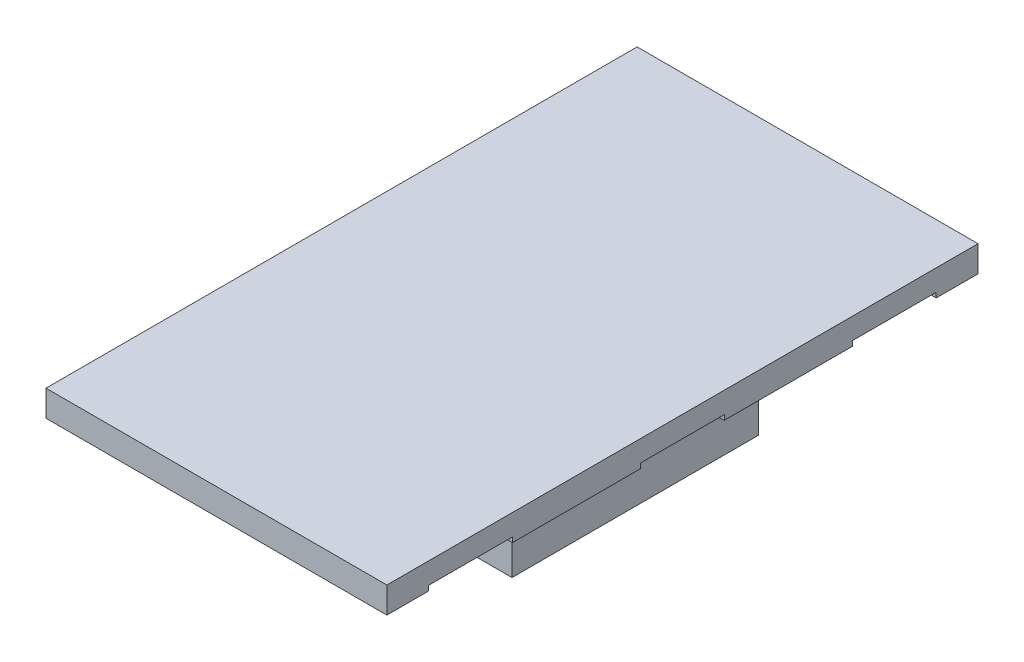
from build123d import *

# Parameters (mm, degrees)
SKETCH1_W           = 6.92
SKETCH1_H           = 12
BOSS_EXTRUDE1_DEPTH = 0.53
SKETCH2_W           = 5
SKETCH2_H           = 5
BOSS_EXTRUDE2_DEPTH = 1.57
SKETCH3_R           = 2
CUT_EXTRUDE1_DEPTH  = 0.2
CHAMFER1_SIZE       = 0.1
SKETCH6_W           = 2
SKETCH6_H           = 1.2
BOSS_EXTRUDE3_DEPTH = 0.45
CUT_EXTRUDE2_DEPTH  = 0.1


with BuildPart() as part:
    # Sketch1 → Boss-Extrude1 (new body)
    with BuildSketch(Plane(origin=(0, 0, 0), x_dir=(1, 0, 0), z_dir=(0, 1, 0))):
        Rectangle(SKETCH1_W, SKETCH1_H)
    extrude(amount=BOSS_EXTRUDE1_DEPTH)

    # Sketch2 → Boss-Extrude2 (add)
    with BuildSketch(Plane.XZ):
        Rectangle(SKETCH2_W, SKETCH2_H)
    extrude(amount=BOSS_EXTRUDE2_DEPTH)

    # Sketch3 → Cut-Extrude1 (cut)
    with BuildSketch(Plane.XZ.offset(1.57)):
        with Locations(Location((0, 0, 0), (0, 0, 270))):
            Circle(SKETCH3_R)
    extrude(amount=-CUT_EXTRUDE1_DEPTH, mode=Mode.SUBTRACT)

    # Chamfer1
    chamfer1_edges = [part.edges().sort_by_distance(p)[0] for p in [
        (0, -1.57, 2),
    ]]
    chamfer(chamfer1_edges, length=CHAMFER1_SIZE)

    # Sketch6 → Boss-Extrude3 (add)
    with BuildSketch(Plane.XZ):
        with Locations((0, -4.25)):
            Rectangle(SKETCH6_W, SKETCH6_H)
    extrude(amount=BOSS_EXTRUDE3_DEPTH)

    # Sketch4 → Cut-Extrude2 (cut)
    with BuildSketch(Plane.XZ):
        with BuildLine():
            Line((3.46, 0.85), (3.46, -0.85))
            ThreePointArc((3.46, -0.85), (2.61, 0), (3.46, 0.85))
        make_face()
        with BuildLine():
            Line((3.46, 5.151541621), (2.351035145, 5.151541621))
            ThreePointArc((2.351035145, 5.151541621), (1.501035145, 4.301541621), (2.351035145, 3.451541621))
            Line((2.351035145, 3.451541621), (3.46, 3.451541621))
            Line((3.46, 3.451541621), (3.46, 5.151541621))
        make_face()
        with BuildLine():
            Line((3.46, -5.151541621), (2.351035145, -5.151541621))
            ThreePointArc((2.351035145, -5.151541621), (1.501035145, -4.301541621), (2.351035145, -3.451541621))
            Line((2.351035145, -3.451541621), (3.46, -3.451541621))
            Line((3.46, -3.451541621), (3.46, -5.151541621))
        make_face()
        with BuildLine():
            Line((-2.351035145, -3.451541621), (-3.46, -3.451541621))
            Line((-3.46, -3.451541621), (-3.46, -5.151541621))
            Line((-3.46, -5.151541621), (-2.351035145, -5.151541621))
            ThreePointArc((-2.351035145, -5.151541621), (-1.501035145, -4.301541621), (-2.351035145, -3.451541621))
        make_face()
        with BuildLine():
            Line((-3.46, 3.451541621), (-3.46, 5.151541621))
            Line((-3.46, 5.151541621), (-2.351035145, 5.151541621))
            ThreePointArc((-2.351035145, 5.151541621), (-1.501035145, 4.301541621), (-2.351035145, 3.451541621))
            Line((-2.351035145, 3.451541621), (-3.46, 3.451541621))
        make_face()
        with BuildLine():
            Line((-3.46, 0.85), (-3.46, -0.85))
            ThreePointArc((-3.46, -0.85), (-2.61, 0), (-3.46, 0.85))
        make_face()
    extrude(amount=-CUT_EXTRUDE2_DEPTH, mode=Mode.SUBTRACT)


solid = part.part
